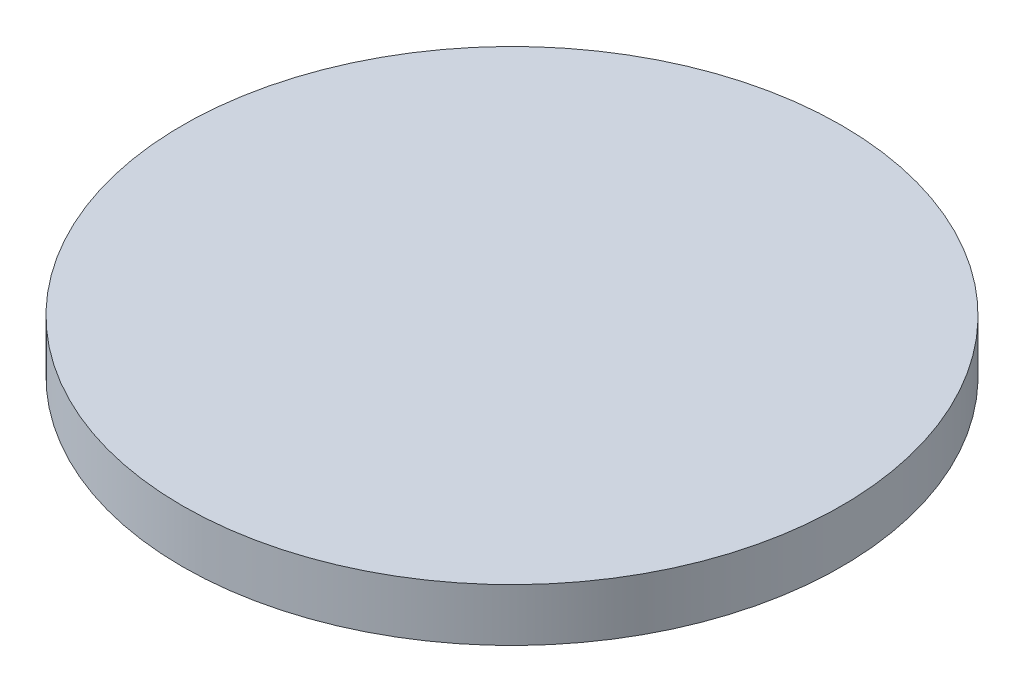
from build123d import *

# Parameters (mm, degrees)
SKETCH1_R           = 12.5
BOSS_EXTRUDE1_DEPTH = 2


with BuildPart() as part:
    # Sketch1 → Boss-Extrude1 (new body)
    with BuildSketch(Plane(origin=(0, 0, 0), x_dir=(1, 0, 0), z_dir=(0, 1, 0))):
        with Locations(Location((0, 0, 0), (0, 0, 270))):
            Circle(SKETCH1_R)
    extrude(amount=BOSS_EXTRUDE1_DEPTH)


solid = part.part
